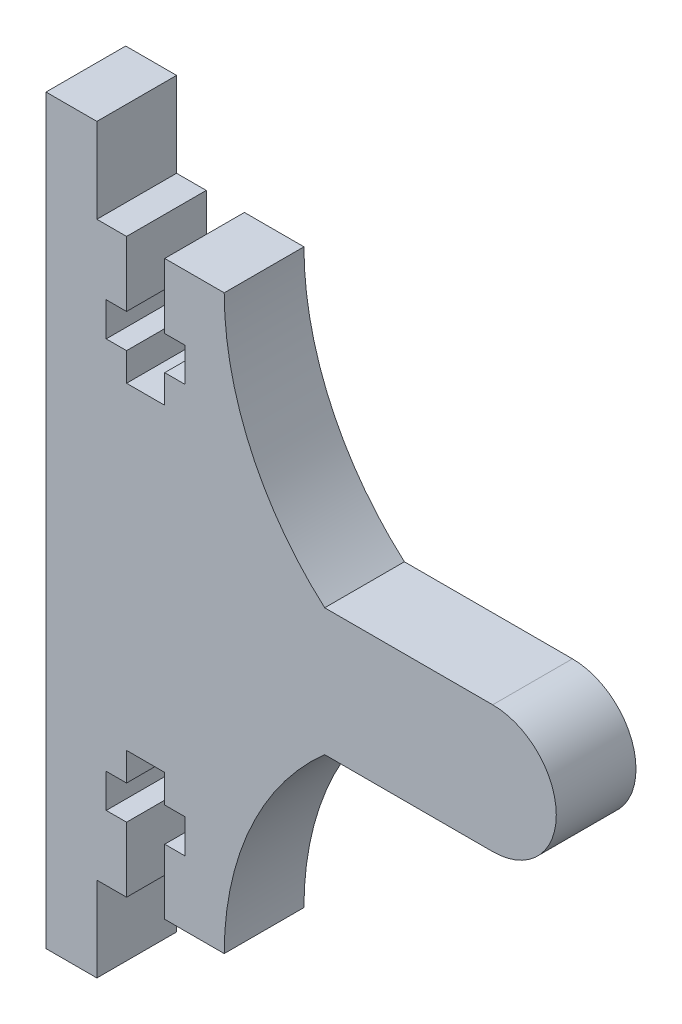
from build123d import *

# Parameters (mm, degrees)
BOSS_EXTRUDE1_DEPTH = 5.64


with BuildPart() as part:
    # Sketch1 → Boss-Extrude1 (new body)
    with BuildSketch(Plane.XY):
        with BuildLine():
            Line((652.899853243, 449.102981641), (641.00965886, 449.102981641))
            ThreePointArc((641.00965886, 449.102981641), (635.75965886, 456.212787258), (633.899853243, 464.852981641))
            Line((633.899853243, 464.852981641), (629.688308144, 464.852981641))
            Line((629.688308144, 464.852981641), (629.688308144, 460.252981641))
            Line((629.688308144, 460.252981641), (631.128193187, 460.252981641))
            Line((631.128193187, 460.252981641), (631.128193187, 457.852930641))
            Line((631.128193187, 457.852930641), (629.688308144, 457.852930641))
            Line((629.688308144, 457.852930641), (629.688308144, 455.852930641))
            Line((629.688308144, 455.852930641), (626.988308144, 455.852930641))
            Line((626.988308144, 455.852930641), (626.988308144, 457.852930641))
            Line((626.988308144, 457.852930641), (625.548423101, 457.852930641))
            Line((625.548423101, 457.852930641), (625.548423101, 460.252981641))
            Line((625.548423101, 460.252981641), (626.988308144, 460.252981641))
            Line((626.988308144, 460.252981641), (626.988308144, 464.852981641))
            Line((626.988308144, 464.852981641), (624.888308144, 464.852981641))
            Line((624.888308144, 464.852981641), (624.888308144, 470.852981641))
            Line((624.888308144, 470.852981641), (621.288308144, 470.852981641))
            Line((621.288308144, 470.852981641), (621.288308144, 464.852981641))
            Line((621.288308144, 464.852981641), (621.288308144, 424.352981641))
            Line((621.288308144, 424.352981641), (621.288308144, 418.352981641))
            Line((621.288308144, 418.352981641), (624.888308144, 418.352981641))
            Line((624.888308144, 418.352981641), (624.888308144, 424.352981641))
            Line((624.888308144, 424.352981641), (626.988308144, 424.352981641))
            Line((626.988308144, 424.352981641), (626.988308144, 428.952981641))
            Line((626.988308144, 428.952981641), (625.548423101, 428.952981641))
            Line((625.548423101, 428.952981641), (625.548423101, 431.353032641))
            Line((625.548423101, 431.353032641), (626.988308144, 431.353032641))
            Line((626.988308144, 431.353032641), (626.988308144, 433.353032641))
            Line((626.988308144, 433.353032641), (629.688308144, 433.353032641))
            Line((629.688308144, 433.353032641), (629.688308144, 431.353032641))
            Line((629.688308144, 431.353032641), (631.128193187, 431.353032641))
            Line((631.128193187, 431.353032641), (631.128193187, 428.952981641))
            Line((631.128193187, 428.952981641), (629.688308144, 428.952981641))
            Line((629.688308144, 428.952981641), (629.688308144, 424.352981641))
            Line((629.688308144, 424.352981641), (633.899853243, 424.352981641))
            ThreePointArc((633.899853243, 424.352981641), (635.75965886, 432.993176024), (641.00965886, 440.102981641))
            Line((641.00965886, 440.102981641), (652.899853243, 440.102981641))
            ThreePointArc((652.899853243, 440.102981641), (657.399853243, 444.602981641), (652.899853243, 449.102981641))
        make_face()
    extrude(amount=BOSS_EXTRUDE1_DEPTH)


solid = part.part
